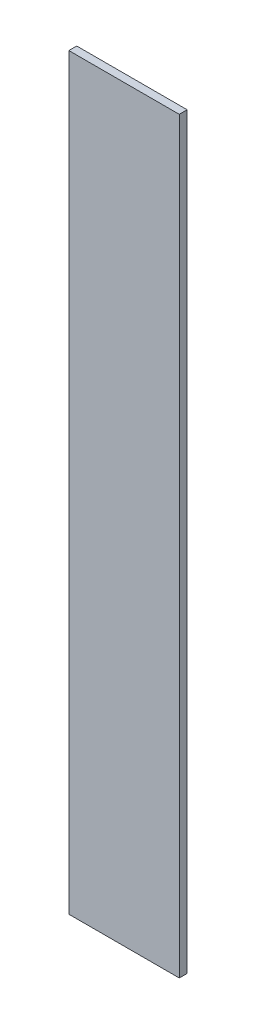
from build123d import *

# Parameters (mm, degrees)
SKETCH2_W           = 602.234
SKETCH2_H           = 88.9
BOSS_EXTRUDE1_DEPTH = 6.35


with BuildPart() as part:
    # Sketch2 → Boss-Extrude1 (new body)
    with BuildSketch(Plane(origin=(0, 0, 0), x_dir=(0, 1, 0), z_dir=(0, 0, 1))):
        with Locations((301.117, 44.45)):
            Rectangle(SKETCH2_W, SKETCH2_H)
    extrude(amount=BOSS_EXTRUDE1_DEPTH)


solid = part.part
